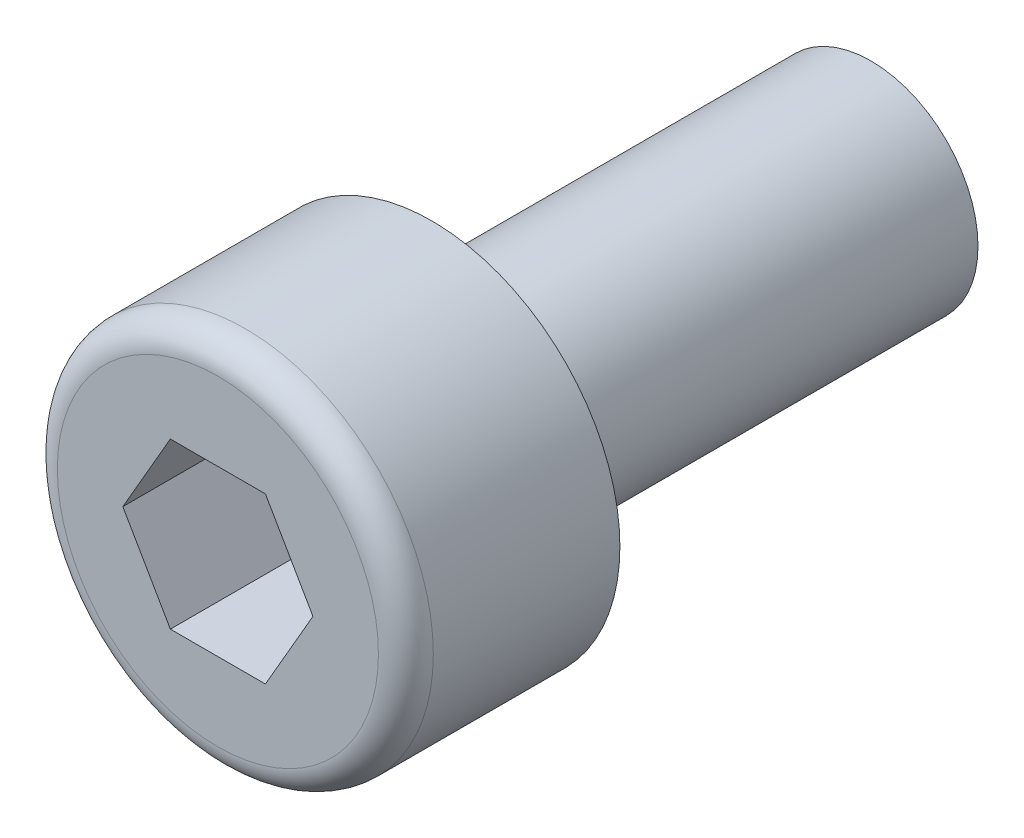
from build123d import *

# Parameters (mm, degrees)
SKETCH1_R           = 3.425
BOSS_EXTRUDE1_DEPTH = 3.9
SKETCH2_R           = 1.95
BOSS_EXTRUDE2_DEPTH = 8
CUT_EXTRUDE1_DEPTH  = 2.5
FILLET1_R           = 0.5


with BuildPart() as part:
    # Sketch1 → Boss-Extrude1 (new body)
    with BuildSketch(Plane.XY):
        Circle(SKETCH1_R)
    extrude(amount=BOSS_EXTRUDE1_DEPTH)

    # Sketch2 → Boss-Extrude2 (add)
    with BuildSketch(Plane(origin=(0, 0, 0), x_dir=(-1, 0, 0), z_dir=(0, 0, -1))):
        Circle(SKETCH2_R)
    extrude(amount=BOSS_EXTRUDE2_DEPTH)

    # Sketch3 → Cut-Extrude1 (cut)
    with BuildSketch(Plane.XY.offset(3.9)):
        Polygon((1.732050808, 0), (0.866025404, 1.5), (-0.866025404, 1.5), (-1.732050808, 0), (-0.866025404, -1.5), (0.866025404, -1.5), align=None)
    extrude(amount=-CUT_EXTRUDE1_DEPTH, mode=Mode.SUBTRACT)

    # Fillet1
    fillet1_edges = [part.edges().sort_by_distance(p)[0] for p in [
        (-3.425, 0, 3.9),
    ]]
    fillet(fillet1_edges, radius=FILLET1_R)


solid = part.part
